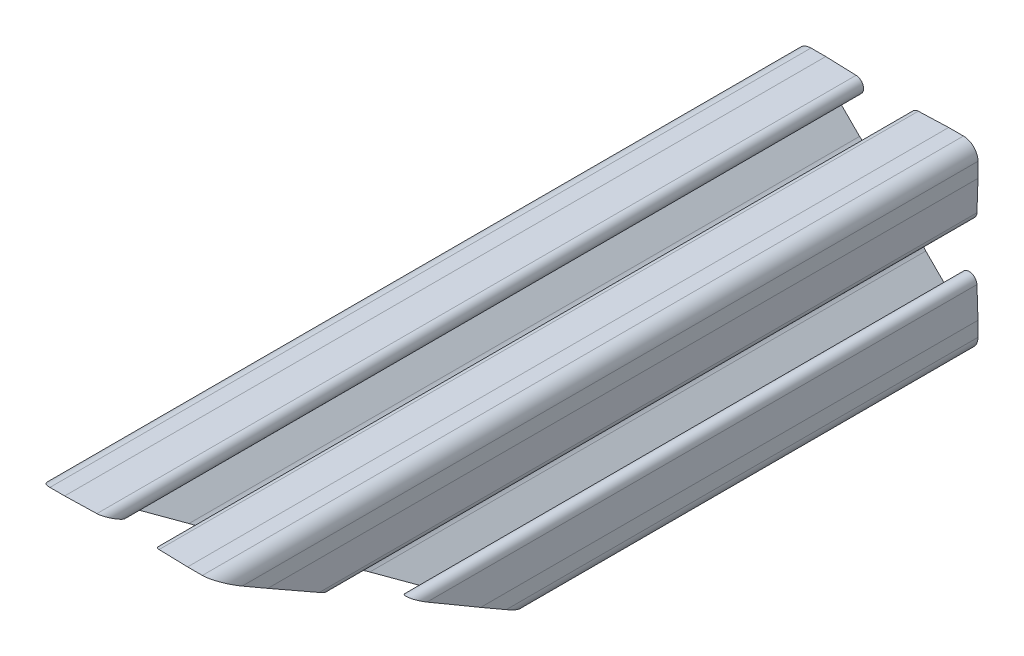
from build123d import *

# Parameters (mm, degrees)
BOSS_EXTRUDE1_DEPTH = 104.775
CUT_EXTRUDE1_DEPTH  = 141.290381243
SKETCH2_R           = 2.54
CUT_EXTRUDE2_DEPTH  = 151.322735518


with BuildPart() as part:
    # Model → Boss-Extrude1 (new body)
    with BuildSketch(Plane.XY):
        with BuildLine():
            Line((50.659960212, 72.999871414), (53.774553856, 72.999871414))
            ThreePointArc((53.774553856, 72.999871414), (54.989573754, 72.758188929), (56.019617887, 72.069935444))
            Line((56.019617887, 72.069935444), (59.264200891, 68.825352439))
            ThreePointArc((59.264200891, 68.825352439), (59.477513437, 67.701802895), (58.510322513, 67.091550869))
            Line((58.510322513, 67.091550869), (56.572487817, 67.159221548))
            ThreePointArc((56.572487817, 67.159221548), (55.4691069, 66.130302197), (56.498026251, 65.026921279))
            Line((56.498026251, 65.026921279), (60.677257034, 64.880979325))
            Line((60.677257034, 64.880979325), (62.710657034, 64.880979325))
            ThreePointArc((62.710657034, 64.880979325), (64.129537501, 65.468698857), (64.717257034, 66.887579325))
            Line((64.717257034, 66.887579325), (64.717257034, 68.920979325))
            Line((64.717257034, 68.920979325), (64.57131508, 73.100210108))
            ThreePointArc((64.57131508, 73.100210108), (63.467934162, 74.129129459), (62.439014811, 73.025748542))
            Line((62.439014811, 73.025748542), (62.50668549, 71.087913846))
            ThreePointArc((62.50668549, 71.087913846), (61.896433464, 70.120722922), (60.77288392, 70.334035468))
            Line((60.77288392, 70.334035468), (57.528300915, 73.578618472))
            ThreePointArc((57.528300915, 73.578618472), (56.84004743, 74.608662605), (56.598364945, 75.823682503))
            Line((56.598364945, 75.823682503), (56.598364945, 78.938276147))
            ThreePointArc((56.598364945, 78.938276147), (56.84004743, 80.153296044), (57.528300915, 81.183340177))
            Line((57.528300915, 81.183340177), (60.77288392, 84.427923182))
            ThreePointArc((60.77288392, 84.427923182), (61.896433464, 84.641235728), (62.50668549, 83.674044803))
            Line((62.50668549, 83.674044803), (62.439014811, 81.736210108))
            ThreePointArc((62.439014811, 81.736210108), (63.467934162, 80.63282919), (64.57131508, 81.661748542))
            Line((64.57131508, 81.661748542), (64.717257034, 85.840979325))
            Line((64.717257034, 85.840979325), (64.717257034, 87.874379325))
            ThreePointArc((64.717257034, 87.874379325), (64.129537501, 89.293259792), (62.710657034, 89.880979325))
            Line((62.710657034, 89.880979325), (60.677257034, 89.880979325))
            Line((60.677257034, 89.880979325), (56.498026251, 89.73503737))
            ThreePointArc((56.498026251, 89.73503737), (55.4691069, 88.631656452), (56.572487817, 87.602737101))
            Line((56.572487817, 87.602737101), (58.510322513, 87.67040778))
            ThreePointArc((58.510322513, 87.67040778), (59.477513437, 87.060155754), (59.264200891, 85.93660621))
            Line((59.264200891, 85.93660621), (56.019617887, 82.692023205))
            ThreePointArc((56.019617887, 82.692023205), (54.989573754, 82.00376972), (53.774553856, 81.762087236))
            Line((53.774553856, 81.762087236), (50.659960212, 81.762087236))
            ThreePointArc((50.659960212, 81.762087236), (49.444940315, 82.00376972), (48.414896182, 82.692023205))
            Line((48.414896182, 82.692023205), (45.170313177, 85.93660621))
            ThreePointArc((45.170313177, 85.93660621), (44.957000631, 87.060155754), (45.924191556, 87.67040778))
            Line((45.924191556, 87.67040778), (47.862026251, 87.602737101))
            ThreePointArc((47.862026251, 87.602737101), (48.965407169, 88.631656452), (47.936487817, 89.73503737))
            Line((47.936487817, 89.73503737), (43.757257034, 89.880979325))
            Line((43.757257034, 89.880979325), (41.723857034, 89.880979325))
            ThreePointArc((41.723857034, 89.880979325), (40.304976567, 89.293259792), (39.717257034, 87.874379325))
            Line((39.717257034, 87.874379325), (39.717257034, 85.840979325))
            Line((39.717257034, 85.840979325), (39.863198989, 81.661748542))
            ThreePointArc((39.863198989, 81.661748542), (40.966579907, 80.63282919), (41.995499258, 81.736210108))
            Line((41.995499258, 81.736210108), (41.927828579, 83.674044803))
            ThreePointArc((41.927828579, 83.674044803), (42.538080605, 84.641235728), (43.661630149, 84.427923182))
            Line((43.661630149, 84.427923182), (46.906213154, 81.183340177))
            ThreePointArc((46.906213154, 81.183340177), (47.594466639, 80.153296044), (47.836149123, 78.938276147))
            Line((47.836149123, 78.938276147), (47.836149123, 75.823682503))
            ThreePointArc((47.836149123, 75.823682503), (47.594466639, 74.608662605), (46.906213154, 73.578618472))
            Line((46.906213154, 73.578618472), (43.661630149, 70.334035468))
            ThreePointArc((43.661630149, 70.334035468), (42.538080605, 70.120722922), (41.927828579, 71.087913846))
            Line((41.927828579, 71.087913846), (41.995499258, 73.025748542))
            ThreePointArc((41.995499258, 73.025748542), (40.966579907, 74.129129459), (39.863198989, 73.100210108))
            Line((39.863198989, 73.100210108), (39.717257034, 68.920979325))
            Line((39.717257034, 68.920979325), (39.717257034, 66.887579325))
            ThreePointArc((39.717257034, 66.887579325), (40.304976567, 65.468698857), (41.723857034, 64.880979325))
            Line((41.723857034, 64.880979325), (43.757257034, 64.880979325))
            Line((43.757257034, 64.880979325), (47.936487817, 65.026921279))
            ThreePointArc((47.936487817, 65.026921279), (48.965407169, 66.130302197), (47.862026251, 67.159221548))
            Line((47.862026251, 67.159221548), (45.924191556, 67.091550869))
            ThreePointArc((45.924191556, 67.091550869), (44.957000631, 67.701802895), (45.170313177, 68.825352439))
            Line((45.170313177, 68.825352439), (48.414896182, 72.069935444))
            ThreePointArc((48.414896182, 72.069935444), (49.444940315, 72.758188929), (50.659960212, 72.999871414))
        make_face()
        with BuildLine():
            Line((50.64953831, 75.433607249), (50.269884959, 75.433607249))
            Line((50.269884959, 75.433607249), (50.269884959, 75.8132606))
            ThreePointArc((50.269884959, 75.8132606), (53.985023987, 79.148746278), (50.64953831, 75.433607249))
        make_face(mode=Mode.SUBTRACT)
    extrude(amount=BOSS_EXTRUDE1_DEPTH)

    # Sketch1 → Cut-Extrude1 (cut, through all)
    with BuildSketch(Plane(origin=(64.717257034, 0, 0), x_dir=(0, 0, -1), z_dir=(1, 0, 0))):
        Polygon((-104.775, 89.880979325), (-104.775, 64.880979325), (-61.473729811, 64.880979325), align=None)
    extrude(amount=-CUT_EXTRUDE1_DEPTH, mode=Mode.SUBTRACT)

    # Sketch2 → Cut-Extrude2 (cut, through all)
    with BuildSketch(Plane(origin=(0, 22.041828653, -12.725855706), x_dir=(1, 0, 0), z_dir=(0, -0.8660254037844364, 0.5000000000000041))):
        with Locations(Location((52.217257034, 110.678301344, 0), (0, 0, 232.185356083))):
            Circle(SKETCH2_R)
    extrude(amount=-CUT_EXTRUDE2_DEPTH, mode=Mode.SUBTRACT)


solid = part.part
